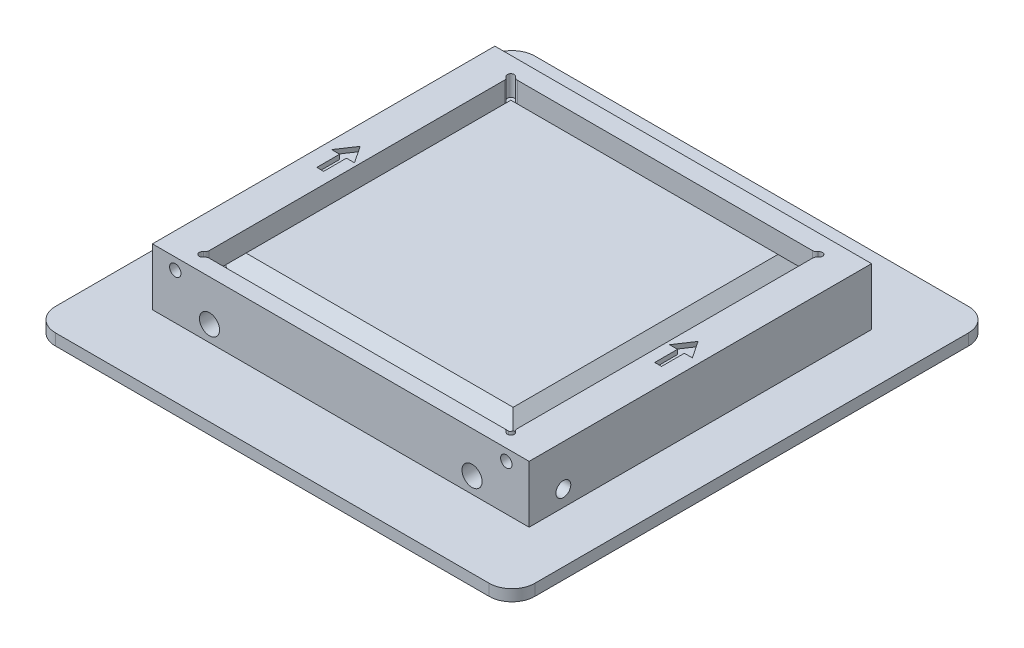
from build123d import *

# Parameters (mm, degrees)
SKETCH1_W           = 165
SKETCH1_H           = 150
BOSS_EXTRUDE1_DEPTH = 30
SKETCH2_W           = 135
SKETCH2_H           = 135
SKETCH2_W_2         = 127
SKETCH2_H_2         = 126
CUT_EXTRUDE1_DEPTH  = 9
CUT_EXTRUDE2_DEPTH  = 2
SKETCH4_R           = 2.5
CUT_EXTRUDE3_DEPTH  = 11
SKETCH5_W           = 210
SKETCH5_H           = 210
BOSS_EXTRUDE2_DEPTH = 5
FILLET1_R           = 10
SKETCH6_R           = 4.4
CUT_EXTRUDE4_DEPTH  = 211.535032714
CHAMFER1_SIZE       = 5
CUT_EXTRUDE5_DEPTH  = 9
FILLET2_R           = 2
SKETCH8_R           = 1.9
CUT_EXTRUDE6_DEPTH  = 25
SKETCH10_R          = 3.25
CUT_EXTRUDE8_DEPTH  = 7.5
SKETCH9_R           = 2.5
CUT_EXTRUDE7_DEPTH  = 10


with BuildPart() as part:
    # Sketch1 → Boss-Extrude1 (new body)
    with BuildSketch(Plane(origin=(0, 0, 0), x_dir=(1, 0, 0), z_dir=(0, 1, 0))):
        Rectangle(SKETCH1_W, SKETCH1_H)
    extrude(amount=BOSS_EXTRUDE1_DEPTH)

    # Sketch2 → Cut-Extrude1 (cut)
    with BuildSketch(Plane(origin=(0, 30, 0), x_dir=(1, 0, 0), z_dir=(0, 1, 0))):
        with Locations((0, -0.5)):
            Rectangle(SKETCH2_W, SKETCH2_H)
        Rectangle(SKETCH2_W_2, SKETCH2_H_2, mode=Mode.SUBTRACT)
    extrude(amount=-CUT_EXTRUDE1_DEPTH, mode=Mode.SUBTRACT)

    # Sketch3 → Cut-Extrude2 (cut)
    with BuildSketch(Plane(origin=(0, 30, 0), x_dir=(1, 0, 0), z_dir=(0, 1, 0))):
        Polygon((75.5, -10), (72.5, -10), (72.5, 0), (69, 0), (74, 7.5), (79, 0), (75.5, 0), align=None)
    cut_extrude2 = extrude(amount=-CUT_EXTRUDE2_DEPTH, mode=Mode.SUBTRACT)

    # Mirror1: Cut-Extrude2 across plane
    add(cut_extrude2.mirror(Plane(origin=(0, 0, 0), x_dir=(0, 0, 1), z_dir=(1, 0, 0))), mode=Mode.SUBTRACT)

    # Sketch4 → Cut-Extrude3 (cut)
    with BuildSketch(Plane.XY.offset(75)):
        with Locations((72.5, 25)):
            Circle(SKETCH4_R)
        with Locations((-72.5, 25)):
            Circle(SKETCH4_R)
    extrude(amount=-CUT_EXTRUDE3_DEPTH, mode=Mode.SUBTRACT)

    # Sketch5 → Boss-Extrude2 (add)
    with BuildSketch(Plane.XZ):
        Rectangle(SKETCH5_W, SKETCH5_H)
    extrude(amount=-BOSS_EXTRUDE2_DEPTH)

    # Fillet1
    fillet1_edges = [part.edges().sort_by_distance(p)[0] for p in [
        (105, 2.5, 105),
        (105, 2.5, -105),
        (-105, 2.5, -105),
        (-105, 2.5, 105),
    ]]
    fillet(fillet1_edges, radius=FILLET1_R)

    # Sketch6 → Cut-Extrude4 (cut, through all)
    with BuildSketch(Plane.XY.offset(75)):
        with Locations((-57.5, 12)):
            Circle(SKETCH6_R)
        with Locations((57.5, 12)):
            Circle(SKETCH6_R)
    extrude(amount=-CUT_EXTRUDE4_DEPTH, mode=Mode.SUBTRACT)

    # Chamfer1
    chamfer1_edges = [part.edges().sort_by_distance(p)[0] for p in [
        (63.5, 30, 0),
        (0, 30, 63),
        (-63.5, 30, 0),
        (0, 30, -63),
    ]]
    chamfer(chamfer1_edges, length=CHAMFER1_SIZE)

    # Sketch7 → Cut-Extrude5 (cut)
    with BuildSketch(Plane(origin=(0, 30, 0), x_dir=(1, 0, 0), z_dir=(0, 1, 0))):
        with BuildLine():
            Line((-67.5, 65.5), (-67.5, 67))
            Line((-67.5, 67), (-66, 67))
            ThreePointArc((-66, 67), (-68.560660172, 68.060660172), (-67.5, 65.5))
        make_face()
        with BuildLine():
            Line((66, 67), (67.5, 67))
            Line((67.5, 67), (67.5, 65.5))
            ThreePointArc((67.5, 65.5), (68.560660172, 68.060660172), (66, 67))
        make_face()
        with BuildLine():
            Line((66, -68), (67.5, -68))
            Line((67.5, -68), (67.5, -66.5))
            ThreePointArc((67.5, -66.5), (68.560660172, -69.060660172), (66, -68))
        make_face()
        with BuildLine():
            Line((-67.5, -66.5), (-67.5, -68))
            Line((-67.5, -68), (-66, -68))
            ThreePointArc((-66, -68), (-68.560660172, -69.060660172), (-67.5, -66.5))
        make_face()
    extrude(amount=-CUT_EXTRUDE5_DEPTH, mode=Mode.SUBTRACT)

    # Fillet2
    fillet2_edges = [part.edges().sort_by_distance(p)[0] for p in [
        (-67.5, 25.5, 66.5),
        (-66, 25.5, 68),
        (66, 25.5, 68),
        (67.5, 25.5, 66.5),
        (67.5, 25.5, -65.5),
        (66, 25.5, -67),
        (-67.5, 25.5, -65.5),
        (-66, 25.5, -67),
        (63.5, 23, 63),
        (-63.5, 23, 63),
        (-63.5, 23, -63),
        (63.5, 23, -63),
    ]]
    fillet(fillet2_edges, radius=FILLET2_R)

    # Sketch8 → Cut-Extrude6 (cut)
    with BuildSketch(Plane(origin=(82.5, 0, 0), x_dir=(0, 0, -1), z_dir=(1, 0, 0))):
        with Locations((-60, 12)):
            Circle(SKETCH8_R)
    cut_extrude6 = extrude(amount=-CUT_EXTRUDE6_DEPTH, mode=Mode.SUBTRACT)

    # Sketch10 → Cut-Extrude8 (cut)
    with BuildSketch(Plane(origin=(82.5, 0, 0), x_dir=(0, 0, -1), z_dir=(1, 0, 0))):
        with Locations((-60, 12)):
            Circle(SKETCH10_R)
    cut_extrude8 = extrude(amount=-CUT_EXTRUDE8_DEPTH, mode=Mode.SUBTRACT)

    # Mirror2: Cut-Extrude6, Cut-Extrude8 across plane
    add(cut_extrude6.mirror(Plane(origin=(0, 0, 0), x_dir=(0, 0, 1), z_dir=(1, 0, 0))), mode=Mode.SUBTRACT)
    add(cut_extrude8.mirror(Plane(origin=(0, 0, 0), x_dir=(0, 0, 1), z_dir=(1, 0, 0))), mode=Mode.SUBTRACT)

    # Sketch9 → Cut-Extrude7 (cut)
    with BuildSketch(Plane(origin=(-82.5, 0, 0), x_dir=(0, 0, -1), z_dir=(1, 0, 0))):
        with Locations((-50, 17.5)):
            Circle(SKETCH9_R)
        with Locations((50, 17.5)):
            Circle(SKETCH9_R)
    extrude(amount=CUT_EXTRUDE7_DEPTH, mode=Mode.SUBTRACT)


solid = part.part
